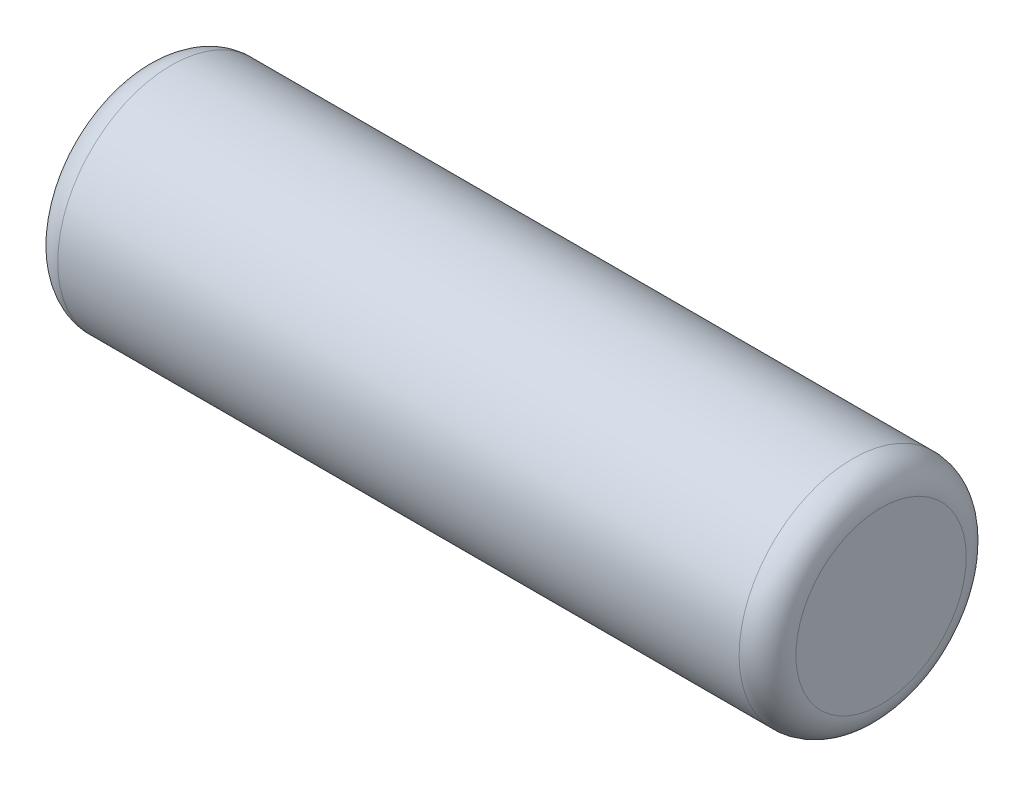
from build123d import *

# Parameters (mm, degrees)
SKETCH_1_R      = 8
EXTRUDE_1_DEPTH = 52
FILLET_2_R      = 2


with BuildPart() as part:
    # Эскиз1 → Бобышка-Вытянуть1 (new body)
    with BuildSketch(Plane(origin=(0, 0, 0), x_dir=(0, 0, -1), z_dir=(1, 0, 0))):
        with Locations(Location((0, 0, 0), (0, 0, 180))):
            Circle(SKETCH_1_R)
    extrude(amount=EXTRUDE_1_DEPTH)

    # Скругление2
    fillet_2_edges = [part.edges().sort_by_distance(p)[0] for p in [
        (0, 0, -8),
        (52, 0, -8),
    ]]
    fillet(fillet_2_edges, radius=FILLET_2_R)


solid = part.part
